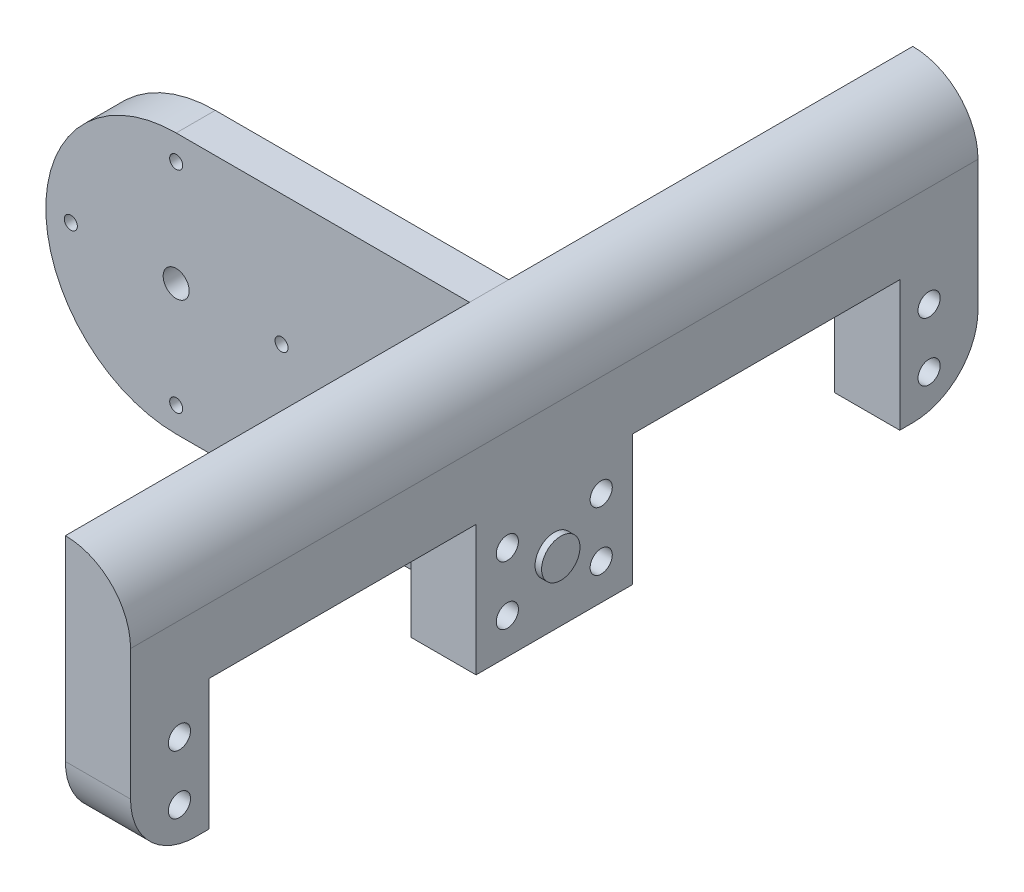
from build123d import *

# Parameters (mm, degrees)
EXTRUDE_1_DEPTH      = 3
EXTRUDE_1_DEPTH_BACK = 3
SKETCH_1_R           = 2
SKETCH_1_R_2         = 1
SKETCH_2_W           = 130
SKETCH_2_H           = 40
EXTRUDE_2_DEPTH      = 10
SKETCH_3_W           = 41
SKETCH_3_H           = 20
CUT_EXTRUDE_1_DEPTH  = 10
FILLET_1_R           = 10
HOLE_WIZARD_M3_1_D   = 3.4
FILLET_4_R           = 10
SKETCH_6_R           = 2.944419646
EXTRUDE_3_DEPTH      = 1


with BuildPart() as part:
    # 스케치1 → 보스-돌출1 (new, two sides: drawn at the far end of the back side and taken through both)
    with BuildSketch(Plane.XY.offset(-EXTRUDE_1_DEPTH_BACK)):
        with BuildLine():
            Line((0, 20), (45, 20))
            Line((45, 20), (45, -20))
            Line((45, -20), (0, -20))
            ThreePointArc((0, -20), (-20, 0), (0, 20))
        make_face()
        Circle(SKETCH_1_R, mode=Mode.SUBTRACT)
        with Locations((0, 16.16)):
            Circle(SKETCH_1_R_2, mode=Mode.SUBTRACT)
        with Locations((16.16, 0)):
            Circle(SKETCH_1_R_2, mode=Mode.SUBTRACT)
        with Locations((0, -16.16)):
            Circle(SKETCH_1_R_2, mode=Mode.SUBTRACT)
        with Locations((-16.16, 0)):
            Circle(SKETCH_1_R_2, mode=Mode.SUBTRACT)
    extrude(amount=EXTRUDE_1_DEPTH + EXTRUDE_1_DEPTH_BACK)

    # 스케치2 → 보스-돌출2 (add)
    with BuildSketch(Plane(origin=(45, 0, 0), x_dir=(0, 0, -1), z_dir=(1, 0, 0))):
        Rectangle(SKETCH_2_W, SKETCH_2_H)
    extrude(amount=EXTRUDE_2_DEPTH)

    # 스케치3 → 컷-돌출1 (cut)
    with BuildSketch(Plane(origin=(55, 0, 0), x_dir=(0, 0, -1), z_dir=(1, 0, 0))):
        with Locations((32.5, -10)):
            Rectangle(SKETCH_3_W, SKETCH_3_H)
        with Locations((-32.5, -10)):
            Rectangle(SKETCH_3_W, SKETCH_3_H)
    extrude(amount=-CUT_EXTRUDE_1_DEPTH, mode=Mode.SUBTRACT)

    # 필렛1
    fillet_1_edges = [part.edges().sort_by_distance(p)[0] for p in [
        (55, 20, 0),
    ]]
    fillet(fillet_1_edges, radius=FILLET_1_R)

    # M3 여유 구멍1 (through all)
    with Locations(Plane(origin=(55, 0, 0), x_dir=(0, 0, -1), z_dir=(1, 0, 0))):
        with Locations((-57.5, -5.5), (-57.5, -14.5), (-7.2, -5.5), (-7.2, -14.5), (7.2, -5.5), (7.2, -14.5), (57.5, -5.5), (57.5, -14.5)):
            Hole(HOLE_WIZARD_M3_1_D / 2)

    # 필렛4
    fillet_4_edges = [part.edges().sort_by_distance(p)[0] for p in [
        (50, -20, -65),
        (50, -20, 65),
    ]]
    fillet(fillet_4_edges, radius=FILLET_4_R)

    # 스케치6 → 보스-돌출3 (add)
    with BuildSketch(Plane(origin=(55, 0, 0), x_dir=(0, 0, -1), z_dir=(1, 0, 0))):
        with Locations(Location((0, -10, 0), (0, 0, 180))):
            Circle(SKETCH_6_R)
    extrude(amount=EXTRUDE_3_DEPTH)


solid = part.part
